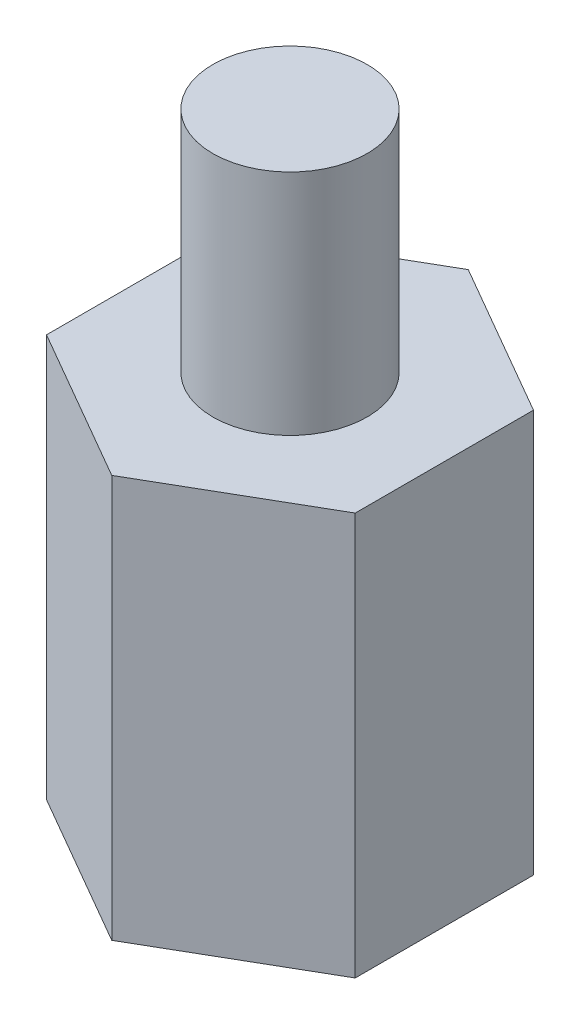
from build123d import *

# Parameters (mm, degrees)
EXTRUDE_1_DEPTH     = 6
SKETCH_2_R          = 1.15
EXTRUDE_2_DEPTH     = 3.4
SKETCH_3_R          = 1.35
CUT_EXTRUDE_1_DEPTH = 4


with BuildPart() as part:
    # Эскиз1 → Бобышка-Вытянуть1 (new body)
    with BuildSketch(Plane(origin=(0, 0, 0), x_dir=(1, 0, 0), z_dir=(0, 1, 0))):
        Polygon((0, 2.655811238), (-2.3, 1.327905619), (-2.3, -1.327905619), (0, -2.655811238), (2.3, -1.327905619), (2.3, 1.327905619), align=None)
    extrude(amount=EXTRUDE_1_DEPTH)

    # Эскиз2 → Бобышка-Вытянуть2 (add)
    with BuildSketch(Plane(origin=(0, 6, 0), x_dir=(1, 0, 0), z_dir=(0, 1, 0))):
        with Locations(Location((0, 0, 0), (0, 0, 270))):
            Circle(SKETCH_2_R)
    extrude(amount=EXTRUDE_2_DEPTH)

    # Эскиз3 → Вырез-Вытянуть1 (cut)
    with BuildSketch(Plane.XZ):
        with Locations(Location((0, 0, 0), (0, 0, 270))):
            Circle(SKETCH_3_R)
    extrude(amount=-CUT_EXTRUDE_1_DEPTH, mode=Mode.SUBTRACT)


solid = part.part
